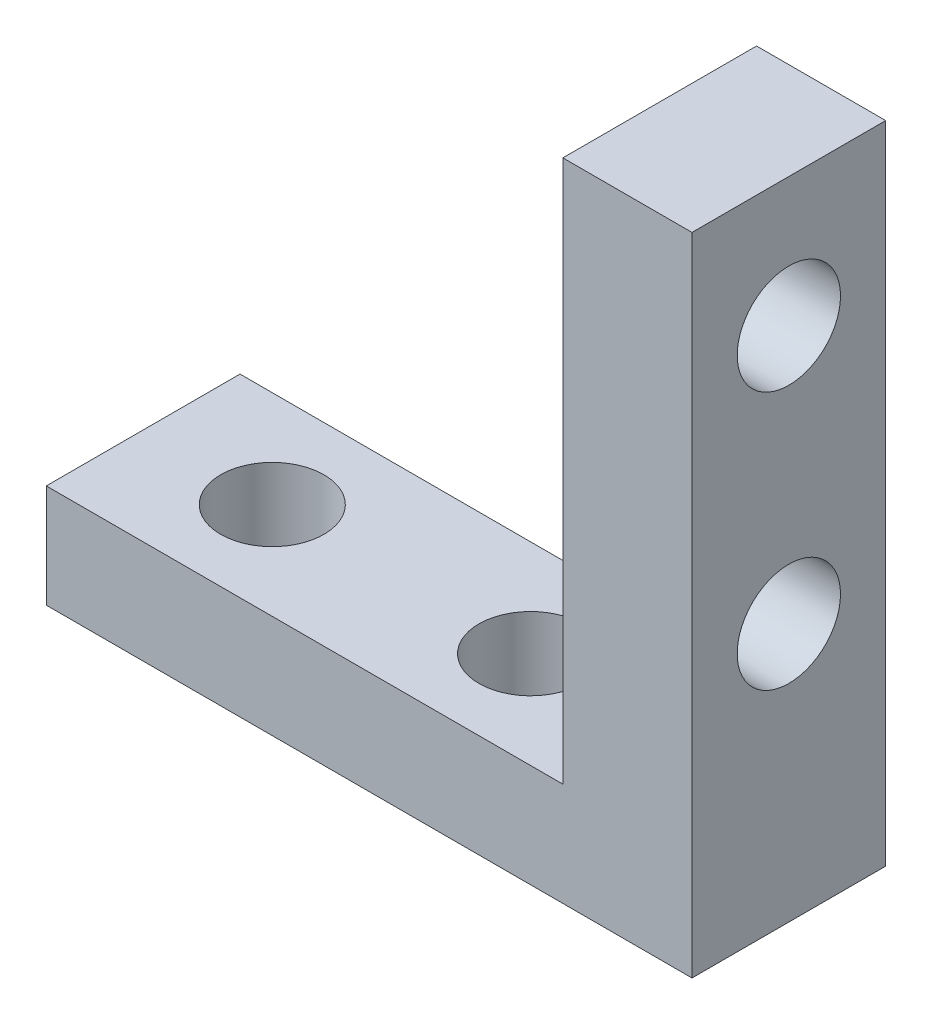
from build123d import *

# Parameters (mm, degrees)
SKETCH1_W           = 20
SKETCH1_H           = 7.5
SKETCH1_R           = 2
BOSS_EXTRUDE1_DEPTH = 4
SKETCH2_W           = 7.5
SKETCH2_H           = 25
SKETCH2_R           = 2
BOSS_EXTRUDE2_DEPTH = 5


with BuildPart() as part:
    # Sketch1 → Boss-Extrude1 (new body)
    with BuildSketch(Plane(origin=(0, 0, 0), x_dir=(1, 0, 0), z_dir=(0, 1, 0))):
        with Locations((-5, 0)):
            Rectangle(SKETCH1_W, SKETCH1_H)
        with Locations(Location((0, 0, 0), (0, 0, 270))):
            Circle(SKETCH1_R, mode=Mode.SUBTRACT)
        with Locations(Location((-10, 0, 0), (0, 0, 270))):
            Circle(SKETCH1_R, mode=Mode.SUBTRACT)
    extrude(amount=BOSS_EXTRUDE1_DEPTH)

    # Sketch2 → Boss-Extrude2 (add)
    with BuildSketch(Plane(origin=(5, 0, 0), x_dir=(0, 0, -1), z_dir=(1, 0, 0))):
        with Locations((0, 12.5)):
            Rectangle(SKETCH2_W, SKETCH2_H)
        with Locations((0, 20)):
            Circle(SKETCH2_R, mode=Mode.SUBTRACT)
        with Locations((0, 10)):
            Circle(SKETCH2_R, mode=Mode.SUBTRACT)
    extrude(amount=BOSS_EXTRUDE2_DEPTH)


solid = part.part
